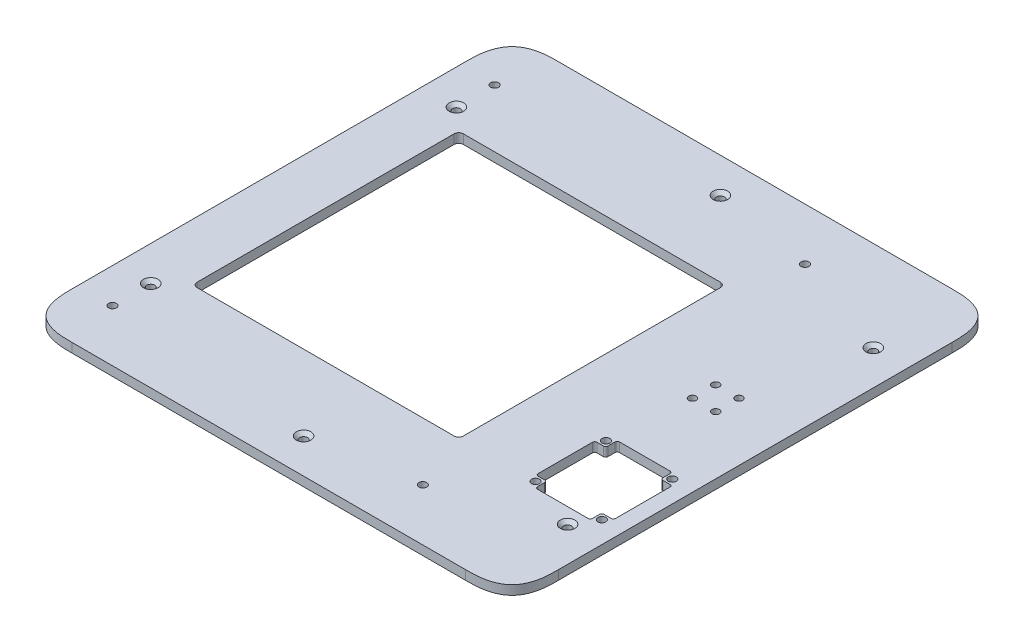
from build123d import *

# Parameters (mm, degrees)
EXTRUDE_1_DEPTH             = 4
HOLE_WIZARD_M32_D           = 3.4
HOLE_WIZARD_M32_CSINK_D     = 6.3
HOLE_WIZARD_M32_CSINK_ANGLE = 90
HOLE_WIZARD_M33_D           = 3.2
HOLE_WIZARD_M33_DEPTH       = 4
HOLE_WIZARD_M33_CSINK_D     = 6.3
HOLE_WIZARD_M33_CSINK_ANGLE = 90
HOLE_WIZARD_M33_TIP         = 0.96137699
HOLE_WIZARD_M34_D           = 3.4
HOLE_WIZARD_M34_CSINK_D     = 6.3
HOLE_WIZARD_M34_CSINK_ANGLE = 90
CUT_EXTRUDE_1_DEPTH         = 149.546289226
FILLET_2_R                  = 1
HOLE_WIZARD_M31_D           = 3.4
HOLE_WIZARD_M32_2_D         = 3.4
CUT_EXTRUDE_2_DEPTH         = 149.546289226


with BuildPart() as part:
    # Эскиз1 → Бобышка-Вытянуть1 (new body)
    with BuildSketch(Plane(origin=(0, 0, 0), x_dir=(1, 0, 0), z_dir=(0, 1, 0))):
        with BuildLine():
            Line((105, -85), (105, 85))
            add(Edge.make_bspline(
                [(105, 85), (105, 86.369045792), (104.987324741, 87.079340582), (104.967212505, 88.206387976), (104.906039071, 89.152584722), (104.761226492, 91.39246541), (104.344744121, 93.263644052), (103.315574629, 97.887513169), (100.621349625, 100.591827179), (97.92113895, 103.302149274), (93.2884849, 104.339199227), (91.417719264, 104.757982368), (89.176835463, 104.90446255), (88.225090112, 104.966675429), (87.089224134, 104.987147489), (86.37611905, 105), (85, 105)],
                knots=[0, 0, 0, 0.0625, 0.0625, 0.125, 0.125, 0.25, 0.25, 0.5, 0.5, 0.75, 0.75, 0.875, 0.875, 0.9375, 0.9375, 1, 1, 1], degree=2))
            Line((85, 105), (-85, 105))
            add(Edge.make_bspline(
                [(-85, 105), (-86.369045792, 105), (-87.079340582, 104.987324741), (-88.206387976, 104.967212505), (-89.152584722, 104.906039071), (-91.39246541, 104.761226492), (-93.263644052, 104.344744121), (-97.88751317, 103.315574629), (-100.591827179, 100.621349625), (-103.302149274, 97.92113895), (-104.339199227, 93.2884849), (-104.757982368, 91.417719265), (-104.90446255, 89.176835463), (-104.966675429, 88.225090111), (-104.987147489, 87.089224134), (-105, 86.376119049), (-105, 85)],
                knots=[0, 0, 0, 0.0625, 0.0625, 0.125, 0.125, 0.25, 0.25, 0.5, 0.5, 0.75, 0.75, 0.875, 0.875, 0.9375, 0.9375, 1, 1, 1], degree=2))
            Line((-105, 85), (-105, -85))
            add(Edge.make_bspline(
                [(-105, -85), (-105, -86.369045791), (-104.987324741, -87.079340582), (-104.967212505, -88.206387976), (-104.906039071, -89.152584722), (-104.761226492, -91.39246541), (-104.344744121, -93.263644052), (-103.315574629, -97.88751317), (-100.621349625, -100.591827179), (-97.92113895, -103.302149274), (-93.2884849, -104.339199227), (-91.417719264, -104.757982368), (-89.176835463, -104.90446255), (-88.225090111, -104.966675429), (-87.089224134, -104.987147489), (-86.37611905, -105), (-85, -105)],
                knots=[0, 0, 0, 0.0625, 0.0625, 0.125, 0.125, 0.25, 0.25, 0.5, 0.5, 0.75, 0.75, 0.875, 0.875, 0.9375, 0.9375, 1, 1, 1], degree=2))
            Line((-85, -105), (85, -105))
            add(Edge.make_bspline(
                [(85, -105), (86.369045792, -105), (87.079340582, -104.987324741), (88.206387976, -104.967212505), (89.152584722, -104.906039071), (91.39246541, -104.761226492), (93.263644052, -104.344744121), (97.887513169, -103.315574629), (100.591827179, -100.621349625), (103.302149273, -97.92113895), (104.339199227, -93.2884849), (104.757982368, -91.417719265), (104.90446255, -89.176835463), (104.966675429, -88.225090112), (104.987147489, -87.089224134), (105, -86.376119051), (105, -85)],
                knots=[0, 0, 0, 0.0625, 0.0625, 0.125, 0.125, 0.25, 0.25, 0.5, 0.5, 0.75, 0.75, 0.875, 0.875, 0.9375, 0.9375, 1, 1, 1], degree=2))
        make_face()
    extrude(amount=EXTRUDE_1_DEPTH)

    # Hole Wizard M32 (through all)
    with Locations(Plane(origin=(0, 4, 0), x_dir=(1, 0, 0), z_dir=(0, 1, 0))):
        with Locations((90, -66), (0, -90), (-90, -66), (0, 90), (-90, 66), (90, 66)):
            CounterSinkHole(HOLE_WIZARD_M32_D / 2, HOLE_WIZARD_M32_CSINK_D / 2, counter_sink_angle=HOLE_WIZARD_M32_CSINK_ANGLE)

    # Зенковка для винта с полупотайной головкой M33
    with Locations(Plane(origin=(0, 0, 0), x_dir=(-1, 0, 0), z_dir=(0, -1, 0))):
        with Locations((-69.829541854, 8.079541854), (-79.870458146, 8.079541854), (-79.870458146, 18.120458146), (-69.829541854, 18.120458146)):
            CounterSinkHole(HOLE_WIZARD_M33_D / 2, HOLE_WIZARD_M33_CSINK_D / 2, depth=HOLE_WIZARD_M33_DEPTH, counter_sink_angle=HOLE_WIZARD_M33_CSINK_ANGLE)
            with Locations((0, 0, -(HOLE_WIZARD_M33_DEPTH + HOLE_WIZARD_M33_TIP / 2))):  # 118° drill point
                Cone(0, HOLE_WIZARD_M33_D / 2, HOLE_WIZARD_M33_TIP, mode=Mode.SUBTRACT)

    # Зенковка для винта с полупотайной головкой M34 (through all)
    with Locations(Plane(origin=(0, 0, 0), x_dir=(-1, 0, 0), z_dir=(0, -1, 0))):
        with Locations((90, 82.5), (-44, 82.5), (-44, -82.5), (90, -82.5)):
            CounterSinkHole(HOLE_WIZARD_M34_D / 2, HOLE_WIZARD_M34_CSINK_D / 2, counter_sink_angle=HOLE_WIZARD_M34_CSINK_ANGLE)

    # Эскиз18 → Вырез-Вытянуть1 (cut, through all)
    with BuildSketch(Plane(origin=(0, 4, 0), x_dir=(1, 0, 0), z_dir=(0, 1, 0))):
        Polygon((64.7, -54.4), (64.7, -29), (69.448080065, -29), (69.448080065, -24), (93.2, -24), (93.2, -29), (98.2, -29), (98.2, -54.4), (93.2, -54.4), (93.2, -59.4), (69.448080065, -59.4), (69.448080065, -54.4), align=None)
    extrude(amount=-CUT_EXTRUDE_1_DEPTH, mode=Mode.SUBTRACT)

    # Скругление2
    fillet_2_edges = [part.edges().sort_by_distance(p)[0] for p in [
        (93.2, 2, 24),
        (93.2, 2, 29),
        (98.2, 2, 29),
        (98.2, 2, 54.4),
        (93.2, 2, 54.4),
        (93.2, 2, 59.4),
        (69.448080065, 2, 59.4),
        (69.448080065, 2, 54.4),
        (64.7, 2, 54.4),
        (64.7, 2, 29),
        (69.448080065, 2, 29),
        (69.448080065, 2, 24),
    ]]
    fillet(fillet_2_edges, radius=FILLET_2_R)

    # Отверстие с зазором M31 (through all)
    with Locations(Plane(origin=(0, 4, 0), x_dir=(1, 0, 0), z_dir=(0, 1, 0))):
        with Locations((95.7, -56.9), (67.074040033, -56.9), (67.074040033, -26.5), (95.7, -26.5)):
            Hole(HOLE_WIZARD_M31_D / 2)

    # Hole Wizard M32 2 (through all)
    with Locations(Plane(origin=(0, 4, 0), x_dir=(1, 0, 0), z_dir=(0, 1, 0))):
        with Locations((67.074040033, -56.9), (95.7, -56.9), (95.7, -26.5), (67.074040033, -26.5)):
            Hole(HOLE_WIZARD_M32_2_D / 2)

    # Эскиз28 → Вырез-Вытянуть2 (cut, through all)
    with BuildSketch(Plane(origin=(0, 4, 0), x_dir=(1, 0, 0), z_dir=(0, 1, 0))):
        with BuildLine():
            Line((-78.5, -57.5), (32.5, -57.5))
            ThreePointArc((32.5, -57.5), (33.914213562, -56.914213562), (34.5, -55.5))
            Line((34.5, -55.5), (34.5, 55.5))
            ThreePointArc((34.5, 55.5), (33.914213562, 56.914213562), (32.5, 57.5))
            Line((32.5, 57.5), (-78.5, 57.5))
            ThreePointArc((-78.5, 57.5), (-79.914213562, 56.914213562), (-80.5, 55.5))
            Line((-80.5, 55.5), (-80.5, -55.5))
            ThreePointArc((-80.5, -55.5), (-79.914213562, -56.914213562), (-78.5, -57.5))
        make_face()
    extrude(amount=-CUT_EXTRUDE_2_DEPTH, mode=Mode.SUBTRACT)


solid = part.part
